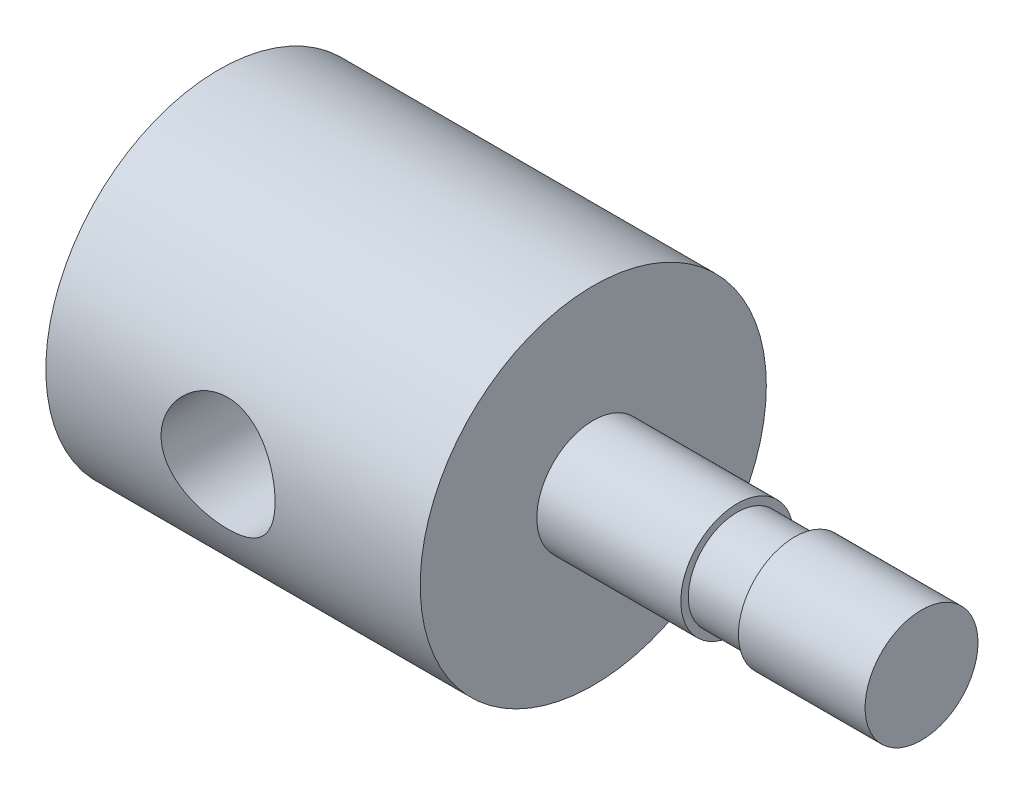
from build123d import *

# Parameters (mm, degrees)
SCHIZZO1_R                    = 3.005
ESTRUSIONE_ESTRUSIONE1_DEPTH  = 6.5
SCHIZZO2_R                    = 0.98
ESTRUSIONE_ESTRUSIONE2_DEPTH  = 2.5
SCHIZZO3_R                    = 0.85
ESTRUSIONE_ESTRUSIONE3_DEPTH  = 1
SCHIZZO4_R                    = 0.98
ESTRUSIONE_ESTRUSIONE4_DEPTH  = 2.2
FORO_FILETTATO_M3X0_5_1_D     = 2.5
FORO_FILETTATO_M3X0_5_1_DEPTH = 5
FORO_FILETTATO_M3X0_5_1_TIP   = 0.751075774
TAGLIO_ESTRUSIONE1_DEPTH      = 13.918980223
TAGLIO_ESTRUSIONE1_DEPTH_BACK = 13.918980223
SCHIZZO7_R                    = 0.99


with BuildPart() as part:
    # Schizzo1 → Estrusione-Estrusione1 (new body)
    with BuildSketch(Plane(origin=(0, 0, 0), x_dir=(0, 0, -1), z_dir=(1, 0, 0))):
        with Locations(Location((0, 0, 0), (0, 0, 180))):
            Circle(SCHIZZO1_R)
    extrude(amount=ESTRUSIONE_ESTRUSIONE1_DEPTH)

    # Schizzo2 → Estrusione-Estrusione2 (add)
    with BuildSketch(Plane(origin=(6.5, 0, 0), x_dir=(0, 0, -1), z_dir=(1, 0, 0))):
        Circle(SCHIZZO2_R)
    extrude(amount=ESTRUSIONE_ESTRUSIONE2_DEPTH)

    # Schizzo3 → Estrusione-Estrusione3 (add)
    with BuildSketch(Plane(origin=(9, 0, 0), x_dir=(0, 0, -1), z_dir=(1, 0, 0))):
        Circle(SCHIZZO3_R)
    extrude(amount=ESTRUSIONE_ESTRUSIONE3_DEPTH)

    # Schizzo4 → Estrusione-Estrusione4 (add)
    with BuildSketch(Plane(origin=(10, 0, 0), x_dir=(0, 0, -1), z_dir=(1, 0, 0))):
        Circle(SCHIZZO4_R)
    extrude(amount=ESTRUSIONE_ESTRUSIONE4_DEPTH)

    # Foro filettato M3x0.5-1
    with Locations(Plane.ZY):
        with Locations((0, 0)):
            Hole(FORO_FILETTATO_M3X0_5_1_D / 2, depth=FORO_FILETTATO_M3X0_5_1_DEPTH)
            with Locations((0, 0, -(FORO_FILETTATO_M3X0_5_1_DEPTH + FORO_FILETTATO_M3X0_5_1_TIP / 2))):  # 118° drill point
                Cone(0, FORO_FILETTATO_M3X0_5_1_D / 2, FORO_FILETTATO_M3X0_5_1_TIP, mode=Mode.SUBTRACT)

    # Schizzo7 → Taglio-Estrusione1 (cut, two sides: drawn at the far end of the back side and taken through both)
    with BuildSketch(Plane.XY.offset(-TAGLIO_ESTRUSIONE1_DEPTH_BACK)):
        with Locations((2.99, 0)):
            Circle(SCHIZZO7_R)
    extrude(amount=TAGLIO_ESTRUSIONE1_DEPTH + TAGLIO_ESTRUSIONE1_DEPTH_BACK, mode=Mode.SUBTRACT)


solid = part.part
